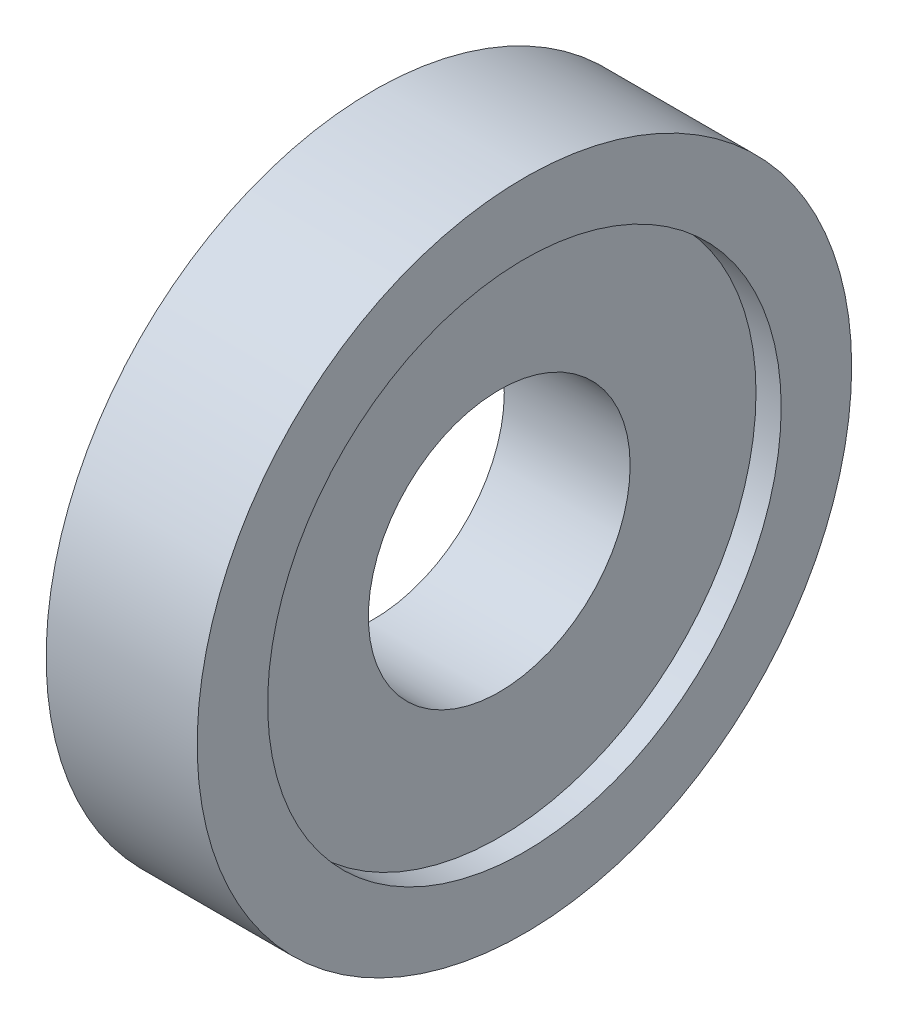
from build123d import *


with BuildPart() as part:
    # 草图1 → 旋转1 (revolve)
    with BuildSketch(Plane.XY, mode=Mode.PRIVATE) as revolve_1_sk:
        Polygon((0, 2.6), (0, 6.5), (3, 6.5), (3, 5.1), (2.5, 5.1), (2.5, 2.6), align=None)
    revolve(revolve_1_sk.sketch.rotate(Axis((3.746031746, 0, 0), (-1, 0, 0)), 90), axis=Axis((3.746031746, 0, 0), (-1, 0, 0)))


solid = part.part
